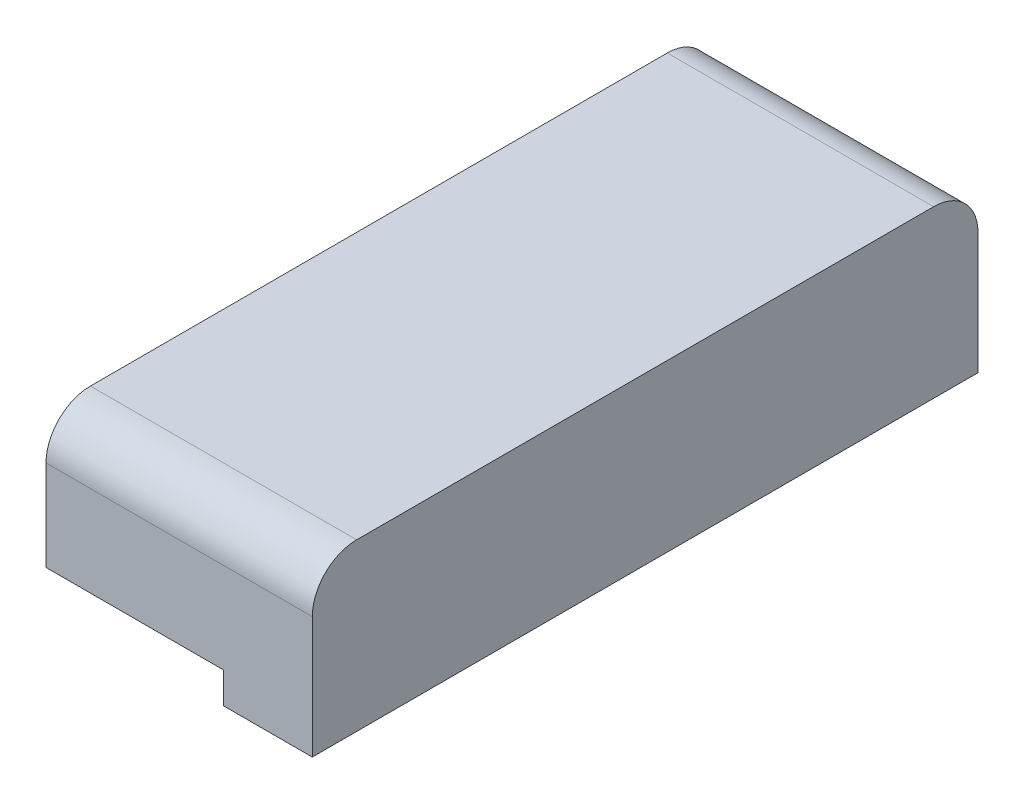
from build123d import *

# Parameters (mm, degrees)
CROQUIS1_W              = 7.5
CROQUIS1_H              = 1.87
SALIENTE_EXTRUIR1_DEPTH = 3
CORTAR_EXTRUIR1_REACH   = 10.132
CROQUIS2_W              = 2
CROQUIS2_H              = 0.35
REDONDEO1_R             = 0.5


with BuildPart() as part:
    # Croquis1 → Saliente-Extruir1 (new body)
    with BuildSketch(Plane(origin=(0, 0, 0), x_dir=(0, 0, -1), z_dir=(1, 0, 0))):
        Rectangle(CROQUIS1_W, CROQUIS1_H)
    extrude(amount=SALIENTE_EXTRUIR1_DEPTH)

    # Croquis2 → Cortar-Extruir1 (cut, up to next)
    with BuildSketch(Plane.XY.offset(3.75), mode=Mode.PRIVATE) as cortar_extruir1_sk1:
        with Locations((1, -0.76)):
            Rectangle(CROQUIS2_W, CROQUIS2_H)
    cortar_extruir1_tool1 = extrude(cortar_extruir1_sk1.sketch, amount=-CORTAR_EXTRUIR1_REACH, mode=Mode.PRIVATE) & part.part
    add(cortar_extruir1_tool1.solids().sort_by_distance((1, -0.76, 3.75))[0], mode=Mode.SUBTRACT)

    # Redondeo1
    redondeo1_edges = [part.edges().sort_by_distance(p)[0] for p in [
        (1.5, 0.935, 3.75),
        (1.5, 0.935, -3.75),
    ]]
    fillet(redondeo1_edges, radius=REDONDEO1_R)


solid = part.part
